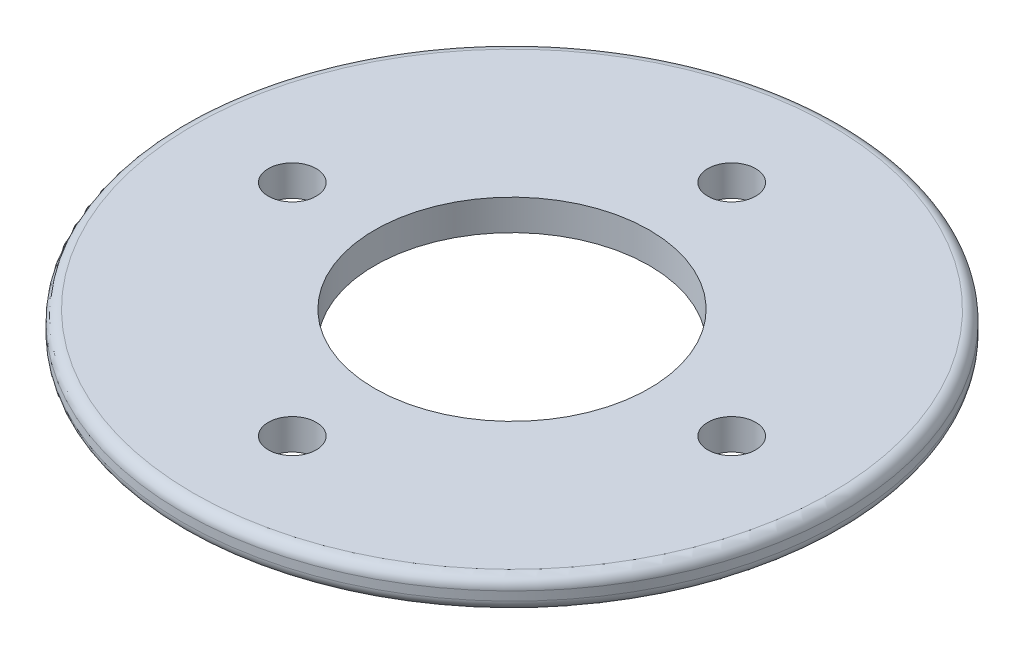
from build123d import *

# Parameters (mm, degrees)
SKETCH1_R           = 15
BOSS_EXTRUDE1_DEPTH = 1.4
SKETCH2_R           = 1.09
CUT_EXTRUDE1_DEPTH  = 1.4
CIRPATTERN1_COUNT   = 4
FILLET1_R           = 0.5
SKETCH5_R           = 6.25
CUT_EXTRUDE2_DEPTH  = 25


with BuildPart() as part:
    # Sketch1 → Boss-Extrude1 (new body)
    with BuildSketch(Plane(origin=(0, 0, 0), x_dir=(1, 0, 0), z_dir=(0, 1, 0))):
        with Locations(Location((0, 0, 0), (0, 0, 270))):
            Circle(SKETCH1_R)
    extrude(amount=BOSS_EXTRUDE1_DEPTH)

    # Sketch2 → Cut-Extrude1 (cut)
    with BuildSketch(Plane(origin=(0, 1.4, 0), x_dir=(1, 0, 0), z_dir=(0, 1, 0))):
        with Locations(Location((0, 10, 0), (0, 0, 270))):
            Circle(SKETCH2_R)
    cut_extrude1 = extrude(amount=-CUT_EXTRUDE1_DEPTH, mode=Mode.SUBTRACT)

    # CirPattern1: Cut-Extrude1 ×4 about axis
    cirpattern1_axis = Axis((0, 0, 0), (0, 1, 0))
    for i in range(1, CIRPATTERN1_COUNT):
        add(cut_extrude1.rotate(cirpattern1_axis, i * 360 / CIRPATTERN1_COUNT), mode=Mode.SUBTRACT)

    # Fillet1
    fillet1_edges = [part.edges().sort_by_distance(p)[0] for p in [
        (0, 0, -15),
        (0, 1.4, -15),
    ]]
    fillet(fillet1_edges, radius=FILLET1_R)

    # Sketch5 → Cut-Extrude2 (cut, symmetric)
    with BuildSketch(Plane(origin=(0, 1.4, 0), x_dir=(1, 0, 0), z_dir=(0, 1, 0))):
        with Locations(Location((0, 0, 0), (0, 0, 270))):
            Circle(SKETCH5_R)
    extrude(amount=CUT_EXTRUDE2_DEPTH, both=True, mode=Mode.SUBTRACT)


solid = part.part
